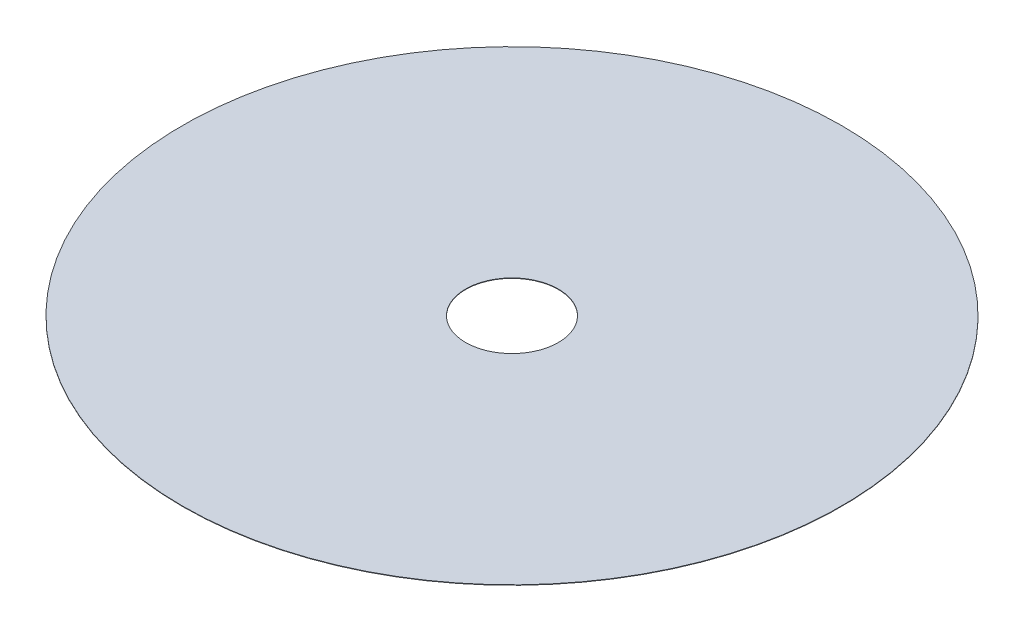
from build123d import *

# Parameters (mm, degrees)
SKETCH1_R           = 195.5
SKETCH1_R_2         = 27.5
BOSS_EXTRUDE1_DEPTH = 0.25


with BuildPart() as part:
    # Sketch1 → Boss-Extrude1 (new body)
    with BuildSketch(Plane(origin=(0, 0, 0), x_dir=(1, 0, 0), z_dir=(0, 1, 0))):
        with Locations(Location((0, 0, 0), (0, 0, 270))):
            Circle(SKETCH1_R)
        with Locations(Location((0, 0, 0), (0, 0, 270))):
            Circle(SKETCH1_R_2, mode=Mode.SUBTRACT)
    extrude(amount=BOSS_EXTRUDE1_DEPTH)


solid = part.part
